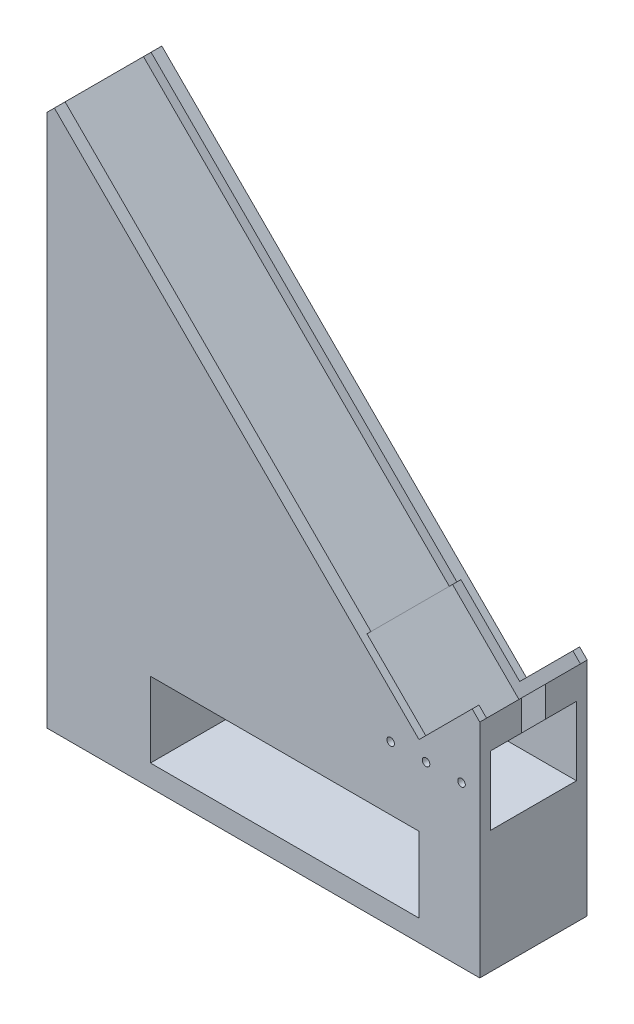
from build123d import *

# Parameters (mm, degrees)
BOSS_EXTRUDE1_DEPTH              = 50
CUT_EXTRUDE1_REACH               = 346.227
CUT_EXTRUDE1_OFFSET_FROM_SURFACE = 10
SKETCH7_W                        = 40
SKETCH7_H                        = 243.120368846
CUT_EXTRUDE2_REACH               = 336.227
SKETCH8_W                        = 40
SKETCH8_H                        = 80.210678119
BOSS_EXTRUDE2_DEPTH              = 5
BOSS_EXTRUDE3_DEPTH              = 5
SKETCH12_W                       = 11
SKETCH12_H                       = 50
CUT_EXTRUDE3_DEPTH               = 20
SKETCH13_W                       = 50
SKETCH13_H                       = 57
BOSS_EXTRUDE4_DEPTH              = 218.275432638
CUT_EXTRUDE5_DEPTH               = 185.855610396
CUT_EXTRUDE5_DEPTH_BACK          = 0.48
SKETCH14_W                       = 40
SKETCH14_H                       = 43.7
SKETCH14_W_2                     = 1.85
CUT_EXTRUDE6_START               = -10
SKETCH15_W                       = 5.5
SKETCH15_H                       = 5
CUT_EXTRUDE6_DEPTH               = 10
SKETCH16_W                       = 125
SKETCH16_H                       = 35
CUT_EXTRUDE7_DEPTH               = 45
CUT_EXTRUDE8_DEPTH               = 5
CUT_EXTRUDE9_DEPTH               = 16.750003
CUT_EXTRUDE10_REACH              = 266.941
SKETCH19_W                       = 6.892135624
SKETCH19_H                       = 14.5
SKETCH20_R                       = 1.75
CUT_EXTRUDE11_DEPTH              = 5


with BuildPart() as part:
    # Sketch2 → Boss-Extrude1 (new body)
    with BuildSketch(Plane.XY):
        Polygon((218.275432638, 103.163478703), (218.275432638, 0), (0, 0), (0, 44.039493547), (0, 248.120368846), (173.241161391, 74.879207455), (201.525432638, 103.163478703), align=None)
    extrude(amount=BOSS_EXTRUDE1_DEPTH)

    # Cut-Extrude1: up to this face of the body (flat: up to its plane, moved by the offset)
    cut_extrude1_end = Plane(part.part.faces().sort_by_distance((86.620580695, 161.499788151, 25))[0]).offset(-CUT_EXTRUDE1_OFFSET_FROM_SURFACE)
    # Sketch7 → Cut-Extrude1 (cut, up to the picked face)
    with BuildSketch(Plane.ZY, mode=Mode.PRIVATE) as cut_extrude1_sk1:
        with Locations((25, 121.560184423)):
            Rectangle(SKETCH7_W, SKETCH7_H)
    cut_extrude1_tool1 = split(extrude(cut_extrude1_sk1.sketch, amount=-CUT_EXTRUDE1_REACH, mode=Mode.PRIVATE), bisect_by=cut_extrude1_end, keep=Keep.BOTH, mode=Mode.PRIVATE)
    add(cut_extrude1_tool1.solids().sort_by(Axis((0, 121.560184, 25), (1, 0, 0)))[0], mode=Mode.SUBTRACT)

    # Cut-Extrude2: up to this plane
    cut_extrude2_end = Plane(origin=(180.312229203, 67.808139643, 50), z_dir=(0.7071067811865477, -0.7071067811865474, 0))
    # Sketch8 → Cut-Extrude2 (cut, up to the surface)
    with BuildSketch(Plane(origin=(218.275432638, 0, 0), x_dir=(0, 0, -1), z_dir=(1, 0, 0)), mode=Mode.PRIVATE) as cut_extrude2_sk1:
        with Locations((-25, 55.808139644)):
            Rectangle(SKETCH8_W, SKETCH8_H)
    cut_extrude2_tool1 = split(extrude(cut_extrude2_sk1.sketch, amount=-CUT_EXTRUDE2_REACH, mode=Mode.PRIVATE), bisect_by=cut_extrude2_end, keep=Keep.BOTH, mode=Mode.PRIVATE)
    add(cut_extrude2_tool1.solids().sort_by_distance((218.275433, 55.80814, 25))[0], mode=Mode.SUBTRACT)

    # Sketch10 → Boss-Extrude2 (add)
    with BuildSketch(Plane.XY.offset(50)):
        Polygon((0, 248.120368846), (3.535533906, 251.655902752), (173.241161391, 81.950275267), (197.989898732, 106.699012609), (201.525432638, 103.163478703), (173.241161391, 74.879207455), align=None)
    extrude(amount=-BOSS_EXTRUDE2_DEPTH)

    # Sketch11 → Boss-Extrude3 (add)
    with BuildSketch(Plane(origin=(0, 0, 0), x_dir=(-1, 0, 0), z_dir=(0, 0, -1))):
        Polygon((-201.525432638, 103.163478703), (-197.989898732, 106.699012609), (-173.241161391, 81.950275267), (-3.535533906, 251.655902752), (0, 248.120368846), (-173.241161391, 74.879207455), align=None)
    extrude(amount=-BOSS_EXTRUDE3_DEPTH)

    # Sketch12 → Cut-Extrude3 (cut)
    with BuildSketch(Plane(origin=(49.180976968, -49.180976968, 0), x_dir=(0, 0, 1), z_dir=(-0.7071067811865435, 0.7071067811865517, 0))):
        with Locations((25, 213.447595361)):
            Rectangle(SKETCH12_W, SKETCH12_H)
    extrude(amount=-CUT_EXTRUDE3_DEPTH, mode=Mode.SUBTRACT)

    # Sketch13 → Boss-Extrude4 (add)
    with BuildSketch(Plane(origin=(218.275432638, 0, 0), x_dir=(0, 0, -1), z_dir=(1, 0, 0))):
        with Locations((-25, 28.5)):
            Rectangle(SKETCH13_W, SKETCH13_H)
    extrude(amount=-BOSS_EXTRUDE4_DEPTH)

    # Sketch14 → Cut-Extrude5 (cut, two sides: drawn at the far end of the back side and taken through both)
    with BuildSketch(Plane(origin=(124.060184423, 124.060184423, 0), x_dir=(0, 0, -1), z_dir=(0.7071067811865435, 0.7071067811865517, 0)).offset(-CUT_EXTRUDE5_DEPTH_BACK)):
        with Locations((-25, -47.702404639)):
            Rectangle(SKETCH14_W, SKETCH14_H)
        with Locations((-45.925, -47.702404639)):
            Rectangle(SKETCH14_W_2, SKETCH14_H)
        with Locations((-4.075, -47.702404639)):
            Rectangle(SKETCH14_W_2, SKETCH14_H)
    extrude(amount=CUT_EXTRUDE5_DEPTH + CUT_EXTRUDE5_DEPTH_BACK, mode=Mode.SUBTRACT)

    # Sketch15 → Cut-Extrude6 (cut)
    with BuildSketch(Plane(origin=(49.180976968, -49.180976968, 0), x_dir=(0, 0, 1), z_dir=(-0.7071067811865477, 0.7071067811865474, 0)).offset(CUT_EXTRUDE6_START)):
        with Locations((27.75, 177.467595361)):
            Rectangle(SKETCH15_W, SKETCH15_H)
        with Locations((22.25, 177.467595361)):
            Rectangle(SKETCH15_W, SKETCH15_H)
    extrude(amount=CUT_EXTRUDE6_DEPTH, mode=Mode.SUBTRACT)

    # Sketch16 → Cut-Extrude7 (cut)
    with BuildSketch(Plane.XY.offset(50)):
        with Locations((110.741161391, 27.5)):
            Rectangle(SKETCH16_W, SKETCH16_H)
    extrude(amount=-CUT_EXTRUDE7_DEPTH, mode=Mode.SUBTRACT)

    # Sketch17 → Cut-Extrude8 (cut)
    with BuildSketch(Plane.XY.offset(5)):
        with BuildLine():
            ThreePointArc((73.991161391, 27.5), (75.741161391, 25.75), (77.491161391, 27.5))
            Line((77.491161391, 27.5), (73.991161391, 27.5))
        make_face()
        with BuildLine():
            Line((73.991161391, 27.5), (77.491161391, 27.5))
            ThreePointArc((77.491161391, 27.5), (75.741161391, 29.25), (73.991161391, 27.5))
        make_face()
        with BuildLine():
            ThreePointArc((108.991161391, 27.5), (110.741161391, 25.75), (112.491161391, 27.5))
            Line((112.491161391, 27.5), (108.991161391, 27.5))
        make_face()
        with BuildLine():
            Line((108.991161391, 27.5), (112.491161391, 27.5))
            ThreePointArc((112.491161391, 27.5), (110.741161391, 29.25), (108.991161391, 27.5))
        make_face()
        with BuildLine():
            ThreePointArc((143.991161391, 27.5), (145.741161391, 25.75), (147.491161391, 27.5))
            Line((147.491161391, 27.5), (143.991161391, 27.5))
        make_face()
        with BuildLine():
            Line((143.991161391, 27.5), (147.491161391, 27.5))
            ThreePointArc((147.491161391, 27.5), (145.741161391, 29.25), (143.991161391, 27.5))
        make_face()
    extrude(amount=-CUT_EXTRUDE8_DEPTH, mode=Mode.SUBTRACT)

    # Sketch18 → Cut-Extrude9 (cut)
    with BuildSketch(Plane(origin=(218.275432638, 0, 0), x_dir=(0, 0, -1), z_dir=(1, 0, 0))):
        Polygon((-5, 95.913478703), (-5, 57), (-45, 57), (-45, 95.913478703), (-30.5, 95.913478703), (-30.5, 103.163478703), (-50, 103.163478703), (-50, 0), (0, 0), (0, 103.163478703), (-19.5, 103.163478703), (-19.5, 95.913478703), align=None)
    extrude(amount=-CUT_EXTRUDE9_DEPTH, mode=Mode.SUBTRACT)

    # Sketch19 → Cut-Extrude10 (cut, up to next)
    with BuildSketch(Plane(origin=(0, 95.913478703, 0), x_dir=(1, 0, 0), z_dir=(0, 1, 0)), mode=Mode.PRIVATE) as cut_extrude10_sk1:
        with Locations((204.97150045, -37.75)):
            Rectangle(SKETCH19_W, SKETCH19_H)
    cut_extrude10_tool1 = extrude(cut_extrude10_sk1.sketch, amount=-CUT_EXTRUDE10_REACH, mode=Mode.PRIVATE) & part.part
    # Sketch19 → Cut-Extrude10 (cut, up to next)
    with BuildSketch(Plane(origin=(0, 95.913478703, 0), x_dir=(1, 0, 0), z_dir=(0, 1, 0)), mode=Mode.PRIVATE) as cut_extrude10_sk2:
        with Locations((204.97150045, -12.25)):
            Rectangle(SKETCH19_W, SKETCH19_H)
    cut_extrude10_tool2 = extrude(cut_extrude10_sk2.sketch, amount=-CUT_EXTRUDE10_REACH, mode=Mode.PRIVATE) & part.part
    add(cut_extrude10_tool1.solids().sort_by_distance((204.9715, 95.913479, 37.75))[0], mode=Mode.SUBTRACT)
    add(cut_extrude10_tool2.solids().sort_by_distance((204.9715, 95.913479, 12.25))[0], mode=Mode.SUBTRACT)

    # Sketch20 → Cut-Extrude11 (cut)
    with BuildSketch(Plane.XY.offset(50)):
        with Locations((176.525432638, 74.5)):
            Circle(SKETCH20_R)
        with Locations((160.025432638, 74.5)):
            Circle(SKETCH20_R)
        with Locations((193.025432638, 74.5)):
            Circle(SKETCH20_R)
    extrude(amount=-CUT_EXTRUDE11_DEPTH, mode=Mode.SUBTRACT)


solid = part.part
